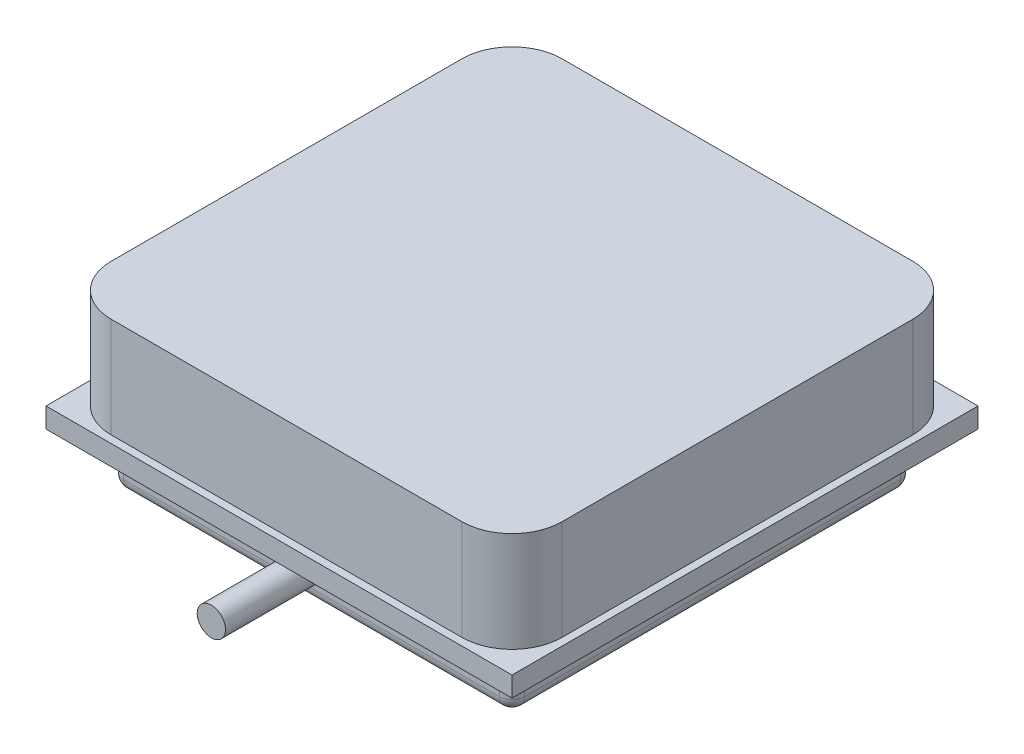
from build123d import *

# Parameters (mm, degrees)
SKETCH1_W    = 18.6
SKETCH1_H    = 18.6
PCB_DEPTH    = 0.8
SKETCH2_W    = 18
SKETCH2_H    = 18
PATCH_DEPTH  = 4
SKETCH3_W    = 16
SKETCH3_H    = 16
RADOME_DEPTH = 2
FILLET1_R    = 2
FILLET2_R    = 0.5
SKETCH4_R    = 0.565
CABLE_DEPTH  = 12


with BuildPart() as part:
    # Sketch1 → PCB (new body)
    with BuildSketch(Plane(origin=(0, 0, 0), x_dir=(1, 0, 0), z_dir=(0, 1, 0))):
        Rectangle(SKETCH1_W, SKETCH1_H)
    extrude(amount=PCB_DEPTH)

    # Sketch2 → PATCH (add)
    with BuildSketch(Plane(origin=(0, 0.8, 0), x_dir=(1, 0, 0), z_dir=(0, 1, 0))):
        Rectangle(SKETCH2_W, SKETCH2_H)
    extrude(amount=PATCH_DEPTH)

    # Sketch3 → RADOME (add)
    with BuildSketch(Plane.XZ):
        Rectangle(SKETCH3_W, SKETCH3_H)
    extrude(amount=RADOME_DEPTH)

    # Fillet1
    fillet1_edges = [part.edges().sort_by_distance(p)[0] for p in [
        (9, 2.8, 9),
        (9, 2.8, -9),
        (-9, 2.8, -9),
        (-9, 2.8, 9),
    ]]
    fillet(fillet1_edges, radius=FILLET1_R)

    # Fillet2
    fillet2_edges = [part.edges().sort_by_distance(p)[0] for p in [
        (8, -1, -8),
        (8, -1, 8),
        (-8, -1, 8),
        (-8, -1, -8),
        (8, -2, 0),
        (0, -2, 8),
        (-8, -2, 0),
        (0, -2, -8),
    ]]
    fillet(fillet2_edges, radius=FILLET2_R)

    # Sketch4 → CABLE (add)
    with BuildSketch(Plane.XY):
        with Locations(Location((0, -0.65, 0), (0, 0, 180))):
            Circle(SKETCH4_R)
    extrude(amount=CABLE_DEPTH)


solid = part.part
